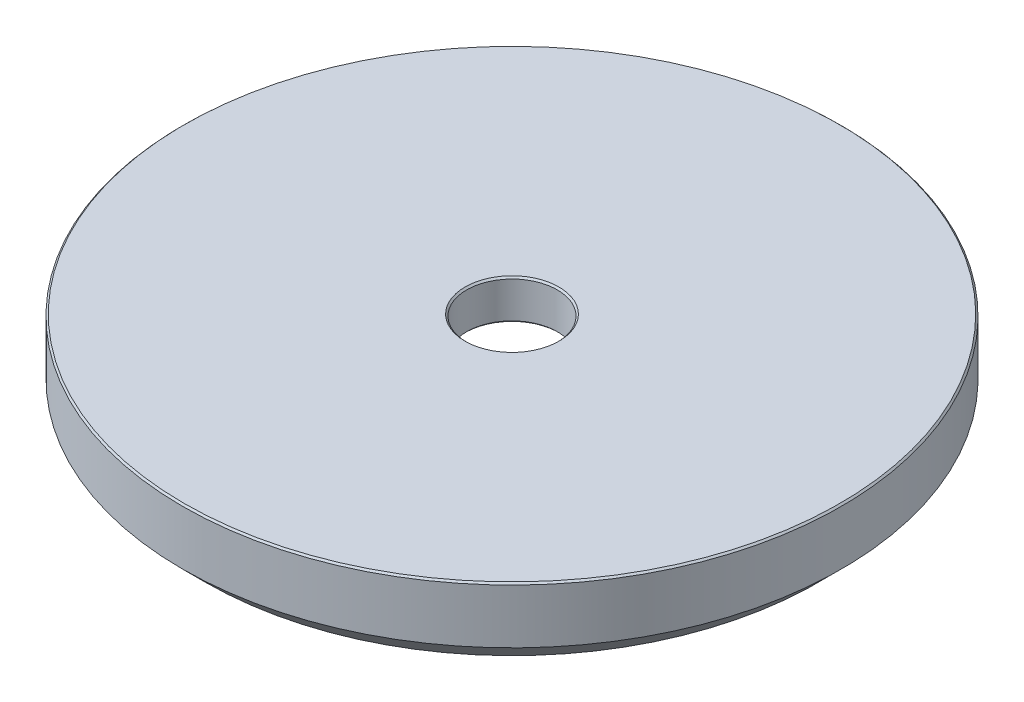
from build123d import *

# Parameters (mm, degrees)
SKETCH_1_W                = 200
SKETCH_1_H                = 48
HOLE_WIZARD_1_D           = 286
HOLE_WIZARD_1_DEPTH       = 15
SKETCH_4_W                = 134
SKETCH_4_H                = 10
SKETCH_5_W                = 7
SKETCH_5_H                = 8
HOLE_WIZARD_3_D           = 55
HOLE_WIZARD_3_CBORE_D     = 125
HOLE_WIZARD_3_CBORE_DEPTH = 19
CHAMFER_1_SIZE2           = 1.000000001
CHAMFER_1_SIZE            = 0.999999999
CHAMFER_2_SIZE            = 2.999999997
CHAMFER_2_SIZE2           = 3.000000003
CHAMFER_3_SIZE            = 13.999999987
CHAMFER_3_SIZE2           = 14.000000013
CHAMFER_4_SIZE            = 1.999999998
CHAMFER_4_SIZE2           = 2.000000002


with BuildPart() as part:
    # 草圖1 → 旋轉1 (revolve)
    with BuildSketch(Plane.XY, mode=Mode.PRIVATE) as revolve_1_sk:
        with Locations((100, 34)):
            Rectangle(SKETCH_1_W, SKETCH_1_H)
    revolve(revolve_1_sk.sketch.rotate(Axis((0, 58, 0), (0, -1, 0)), 270), axis=Axis((0, 58, 0), (0, -1, 0)))

    # 鑽孔1
    with Locations(Plane(origin=(0, 10, 0), x_dir=(-1, 0, 0), z_dir=(0, -1, 0))):
        with Locations((0, 0)):
            Hole(HOLE_WIZARD_1_D / 2, depth=HOLE_WIZARD_1_DEPTH)

    # 草圖4 → 旋轉2 (revolve)
    with BuildSketch(Plane.XY, mode=Mode.PRIVATE) as revolve_2_sk:
        with Locations((67, 20)):
            Rectangle(SKETCH_4_W, SKETCH_4_H)
    revolve(revolve_2_sk.sketch.rotate(Axis((0, 25, 0), (0, -1, 0)), 270), axis=Axis((0, 25, 0), (0, -1, 0)))

    # 草圖5 → 除料-旋轉1 (revolve, cut)
    with BuildSketch(Plane.XY, mode=Mode.PRIVATE) as cut_revolve_1_sk:
        with Locations((146.5, 14)):
            Rectangle(SKETCH_5_W, SKETCH_5_H)
    revolve(cut_revolve_1_sk.sketch.rotate(Axis((0, 18, 0), (0, -1, 0)), 270), axis=Axis((0, 18, 0), (0, -1, 0)), mode=Mode.SUBTRACT)

    # 鑽孔3 (through all)
    with Locations(Plane(origin=(0, 15, 0), x_dir=(-1, 0, 0), z_dir=(0, -1, 0))):
        with Locations((0, 0)):
            CounterBoreHole(HOLE_WIZARD_3_D / 2, HOLE_WIZARD_3_CBORE_D / 2, HOLE_WIZARD_3_CBORE_DEPTH)

    # 導角1
    chamfer_1_edges = [part.edges().sort_by_distance(p)[0] for p in [
        (62.5, 15, 0),
        (-27.5, 58, 0),
        (-27.5, 34, 0),
        (0, 58, 200),
    ]]
    chamfer(chamfer_1_edges, length=CHAMFER_1_SIZE, length2=CHAMFER_1_SIZE2)

    # 導角2
    chamfer_2_edges = [part.edges().sort_by_distance(p)[0] for p in [
        (0, 10, 150),
    ]]
    chamfer_2_side = [part.faces().sort_by_distance(p)[0] for p in [
        (0, 10, 194.343145751),
    ]]
    chamfer(chamfer_2_edges, length=CHAMFER_2_SIZE, length2=CHAMFER_2_SIZE2, reference=chamfer_2_side[0])

    # 導角3
    chamfer_3_edges = [part.edges().sort_by_distance(p)[0] for p in [
        (0, 10, 200),
    ]]
    chamfer_3_side = [part.faces().sort_by_distance(p)[0] for p in [
        (0, 10, 158.656854247),
    ]]
    chamfer(chamfer_3_edges, length=CHAMFER_3_SIZE, length2=CHAMFER_3_SIZE2, reference=chamfer_3_side[0])

    # 導角4
    chamfer_4_edges = [part.edges().sort_by_distance(p)[0] for p in [
        (-143, 18, 0),
    ]]
    chamfer_4_side = [part.faces().sort_by_distance(p)[0] for p in [
        (0, 18, 145.757359313),
    ]]
    chamfer(chamfer_4_edges, length=CHAMFER_4_SIZE, length2=CHAMFER_4_SIZE2, reference=chamfer_4_side[0])


solid = part.part
